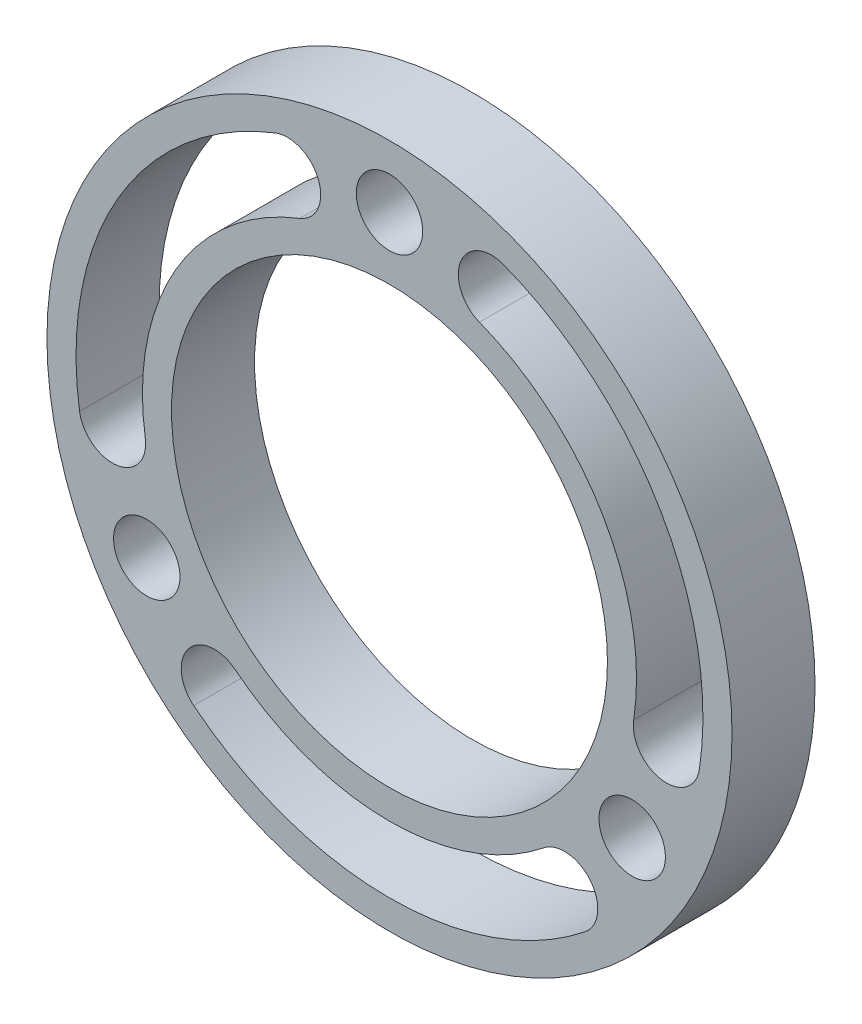
from build123d import *

# Parameters (mm, degrees)
SKETCH_1_R      = 16.5
SKETCH_1_R_2    = 10.5
SKETCH_1_R_3    = 1.6
EXTRUDE_1_DEPTH = 4


with BuildPart() as part:
    # 草图1 → 凸台-拉伸1 (new body)
    with BuildSketch(Plane.XY):
        Circle(SKETCH_1_R)
        Circle(SKETCH_1_R_2, mode=Mode.SUBTRACT)
        with Locations((0, 13.5)):
            Circle(SKETCH_1_R_3, mode=Mode.SUBTRACT)
        with Locations((11.691342951, -6.75)):
            Circle(SKETCH_1_R_3, mode=Mode.SUBTRACT)
        with Locations((-11.691342951, -6.75)):
            Circle(SKETCH_1_R_3, mode=Mode.SUBTRACT)
        with BuildLine():
            ThreePointArc((-4.331175309, 11.083813443), (-3.423257577, 13.156416973), (-5.495861107, 14.064334705))
            ThreePointArc((-5.495861107, 14.064334705), (-13.076983597, 7.55), (-14.928001695, -2.272612018))
            ThreePointArc((-14.928001695, -2.272612018), (-13.10542011, -3.613580461), (-11.764451667, -1.790998875))
            ThreePointArc((-11.764451667, -1.790998875), (-10.305702305, 5.95), (-4.331175309, 11.083813443))
        make_face(mode=Mode.SUBTRACT)
        with BuildLine():
            ThreePointArc((11.764451667, -1.790998876), (13.10542011, -3.613580461), (14.928001695, -2.272612019))
            ThreePointArc((14.928001695, -2.272612019), (13.076983597, 7.55), (5.495861107, 14.064334705))
            ThreePointArc((5.495861107, 14.064334705), (3.423257577, 13.156416973), (4.331175309, 11.083813443))
            ThreePointArc((4.331175309, 11.083813443), (10.305702305, 5.95), (11.764451667, -1.790998876))
        make_face(mode=Mode.SUBTRACT)
        with BuildLine():
            ThreePointArc((-7.433276358, -9.292814568), (-9.682162533, -9.542836512), (-9.432140589, -11.791722687))
            ThreePointArc((-9.432140589, -11.791722687), (0, -15.1), (9.432140588, -11.791722687))
            ThreePointArc((9.432140588, -11.791722687), (9.682162533, -9.542836512), (7.433276358, -9.292814568))
            ThreePointArc((7.433276358, -9.292814568), (0, -11.9), (-7.433276358, -9.292814568))
        make_face(mode=Mode.SUBTRACT)
    extrude(amount=EXTRUDE_1_DEPTH)


solid = part.part
